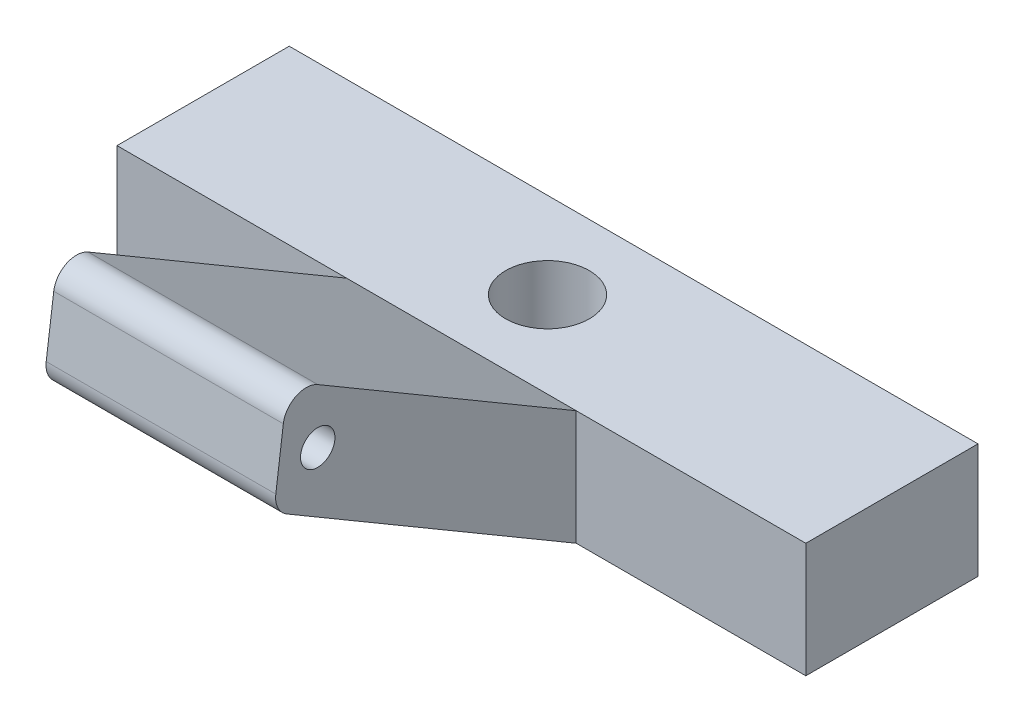
from build123d import *

# Parameters (mm, degrees)
ESQUISSE1_W             = 60
ESQUISSE1_H             = 15
ESQUISSE1_R             = 3.64432939
BOSS_EXTRU_2_DEPTH      = 10
BOSS_EXTRU_3_DEPTH      = 10
BOSS_EXTRU_3_DEPTH_BACK = 10
ESQUISSE2_R             = 1.5


with BuildPart() as part:
    # Esquisse1 → Boss.-Extru.2 (new body)
    with BuildSketch(Plane(origin=(0, 0, 0), x_dir=(1, 0, 0), z_dir=(0, 1, 0))):
        Rectangle(ESQUISSE1_W, ESQUISSE1_H)
        with Locations(Location((0, 0, 0), (0, 0, 270))):
            Circle(ESQUISSE1_R, mode=Mode.SUBTRACT)
    extrude(amount=BOSS_EXTRU_2_DEPTH)

    # Esquisse2 → Boss.-Extru.3 (add, two sides: drawn at the far end of the back side and taken through both)
    with BuildSketch(Plane(origin=(0, 0, 0), x_dir=(0, 0, -1), z_dir=(1, 0, 0)).offset(-BOSS_EXTRU_3_DEPTH_BACK)):
        with BuildLine():
            Line((-7.5, 0), (-32.699931919, 14.80760574))
            ThreePointArc((-32.699931919, 14.80760574), (-33.484005092, 15.654628224), (-33.66947754, 16.793846289))
            Line((-33.66947754, 16.793846289), (-33.012420508, 21.768308704))
            ThreePointArc((-33.012420508, 21.768308704), (-31.906962943, 23.303717227), (-30.016409528, 23.230754593))
            Line((-30.016409528, 23.230754593), (-7.5, 10))
            Line((-7.5, 10), (-7.5, 0))
        make_face()
        with Locations((-30.016409528, 18.484014396)):
            Circle(ESQUISSE2_R, mode=Mode.SUBTRACT)
    extrude(amount=BOSS_EXTRU_3_DEPTH + BOSS_EXTRU_3_DEPTH_BACK)


solid = part.part
